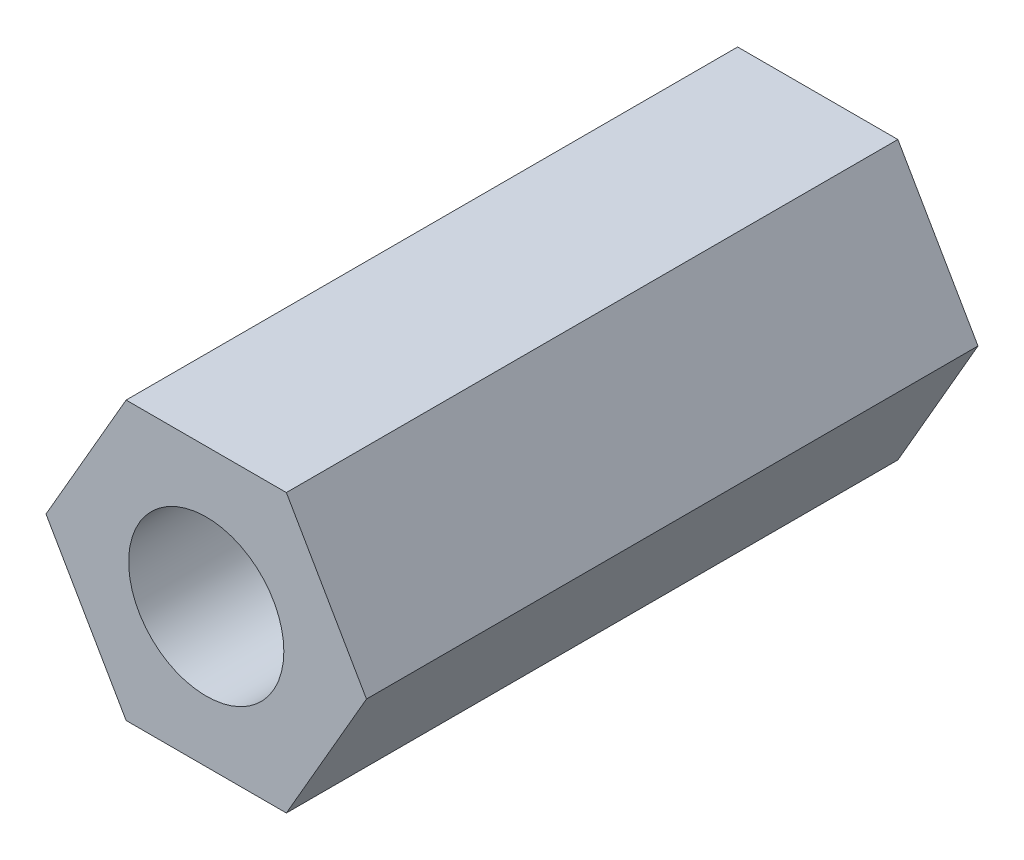
from build123d import *

# Parameters (mm, degrees)
EXTRUDE_1_DEPTH    = 13
HOLE_WIZARD_M4_1_D = 3.3


with BuildPart() as part:
    # 草图1 → 凸台-拉伸1 (new body)
    with BuildSketch(Plane.XY):
        Polygon((1.703183294, 2.95), (-1.703183294, 2.95), (-3.406366588, 0), (-1.703183294, -2.95), (1.703183294, -2.95), (3.406366588, 0), align=None)
    extrude(amount=EXTRUDE_1_DEPTH)

    # M4 螺纹孔1 (through all)
    with Locations(Plane.XY.offset(13)):
        with Locations((0, 0)):
            Hole(HOLE_WIZARD_M4_1_D / 2)


solid = part.part
